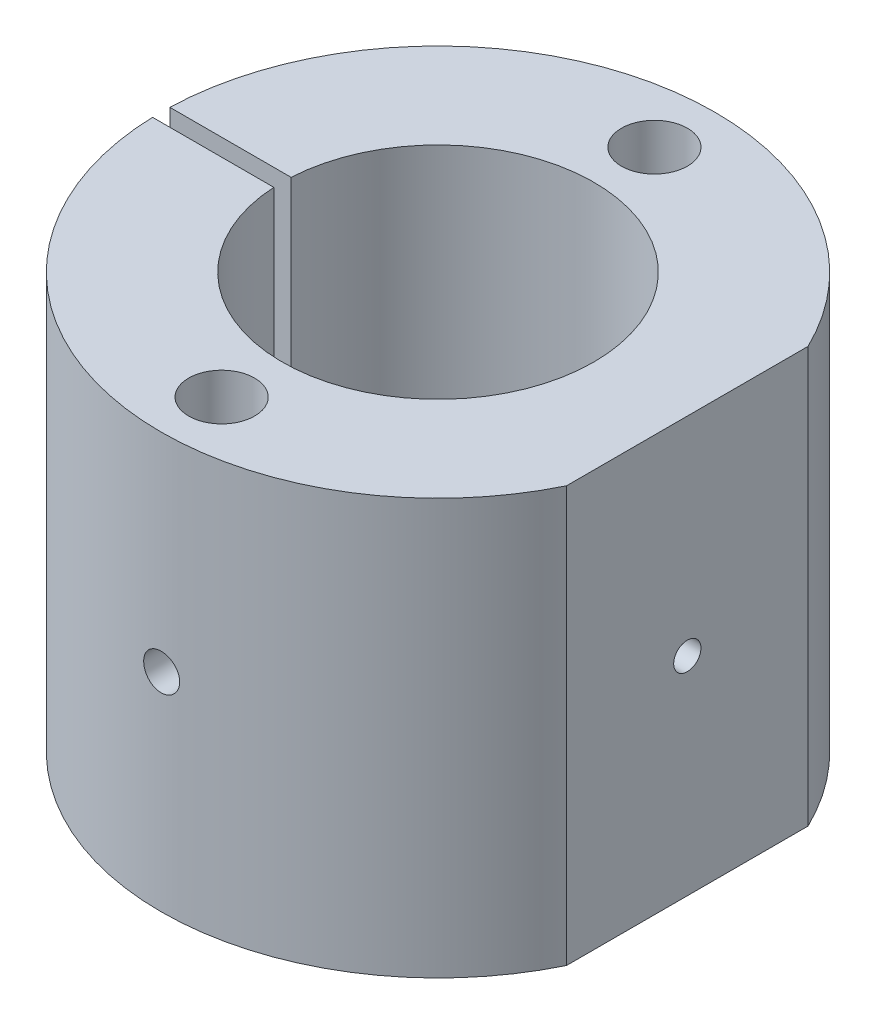
from build123d import *

# Parameters (mm, degrees)
SKETCH2_R                        = 25.4
SKETCH2_R_2                      = 14.2875
BOSS_EXTRUDE1_DEPTH              = 38.1
CUT_EXTRUDE1_REACH               = 54.363
SKETCH3_W                        = 25.4
SKETCH3_H                        = 1.5875
CUT_EXTRUDE2_REACH               = 54.363
SKETCH4_R                        = 3.0226
TAP_DRILL_FOR_M4X0_7_TAP1_REACH  = 61.824
TAP_DRILL_FOR_M4X0_7_TAP1_BORE_R = 1.65
CUT_EXTRUDE5_REACH               = 70.392
CUT_EXTRUDE5_END_RADIUS          = 3.0226
SKETCH11_R                       = 1.65
CUT_EXTRUDE6_REACH               = 54.363
TAP_DRILL_FOR_M3X0_5_TAP2_D      = 2.5
TAP_DRILL_FOR_M3X0_5_TAP2_DEPTH  = 4.572
TAP_DRILL_FOR_M3X0_5_TAP2_TIP    = 0.751075774
TAP_DRILL_FOR_M5X0_8_TAP1_REACH  = 55.583
TAP_DRILL_FOR_M5X0_8_TAP1_BORE_R = 2.1
SKETCH15_R                       = 2.665
CUT_EXTRUDE7_DEPTH               = 53.7470617
CUT_EXTRUDE8_REACH               = 59.143
SKETCH19_R                       = 5
SKETCH21_R                       = 2.665
CUT_EXTRUDE10_DEPTH              = 10


with BuildPart() as part:
    # Sketch2 → Boss-Extrude1 (new body)
    with BuildSketch(Plane(origin=(0, 0, 0), x_dir=(1, 0, 0), z_dir=(0, 1, 0))):
        with Locations(Location((0, 0, 0), (0, 0, 90))):
            Circle(SKETCH2_R)
        with Locations(Location((0, 0, 0), (0, 0, 90))):
            Circle(SKETCH2_R_2, mode=Mode.SUBTRACT)
    extrude(amount=BOSS_EXTRUDE1_DEPTH)

    # Sketch3 → Cut-Extrude1 (cut, up to next)
    with BuildSketch(Plane(origin=(0, 38.1, 0), x_dir=(1, 0, 0), z_dir=(0, 1, 0)), mode=Mode.PRIVATE) as cut_extrude1_sk1:
        with Locations((-12.7, 0)):
            Rectangle(SKETCH3_W, SKETCH3_H)
    cut_extrude1_tool1 = extrude(cut_extrude1_sk1.sketch, amount=-CUT_EXTRUDE1_REACH, mode=Mode.PRIVATE) & part.part
    add(cut_extrude1_tool1.solids().sort_by_distance((-12.7, 38.1, 0))[0], mode=Mode.SUBTRACT)

    # Sketch4 → Cut-Extrude2 (cut, up to next)
    with BuildSketch(Plane(origin=(0, 38.1, 0), x_dir=(1, 0, 0), z_dir=(0, 1, 0)), mode=Mode.PRIVATE) as cut_extrude2_sk1:
        with Locations(Location((0, -19.84375, 0), (0, 0, 270))):
            Circle(SKETCH4_R)
    cut_extrude2_tool1 = extrude(cut_extrude2_sk1.sketch, amount=-CUT_EXTRUDE2_REACH, mode=Mode.PRIVATE) & part.part
    cut_extrude2 = cut_extrude2_tool1.solids().sort_by_distance((0, 38.1, 19.84375))[0]
    add(cut_extrude2, mode=Mode.SUBTRACT)

    # Tap Drill for M4x0.7 Tap1 bore (on position points) → Tap Drill for M4x0.7 Tap1 (cut, up to next)
    with BuildSketch(Plane(origin=(-19.826514488, 29.109235595, 0.79375), x_dir=(-1, 0, 0), z_dir=(0, 0, -1)), mode=Mode.PRIVATE) as tap_drill_for_m4x0_7_tap1_sk1:
        Circle(TAP_DRILL_FOR_M4X0_7_TAP1_BORE_R)
    tap_drill_for_m4x0_7_tap1_tool1 = extrude(tap_drill_for_m4x0_7_tap1_sk1.sketch, amount=-TAP_DRILL_FOR_M4X0_7_TAP1_REACH, mode=Mode.PRIVATE) & part.part
    # Tap Drill for M4x0.7 Tap1 bore (on position points) → Tap Drill for M4x0.7 Tap1 (cut, up to next)
    with BuildSketch(Plane(origin=(-19.826514488, 29.109235595, 0.79375), x_dir=(-1, 0, 0), z_dir=(0, 0, -1)), mode=Mode.PRIVATE) as tap_drill_for_m4x0_7_tap1_sk2:
        with Locations((0, -20.205281104)):
            Circle(TAP_DRILL_FOR_M4X0_7_TAP1_BORE_R)
    tap_drill_for_m4x0_7_tap1_tool2 = extrude(tap_drill_for_m4x0_7_tap1_sk2.sketch, amount=-TAP_DRILL_FOR_M4X0_7_TAP1_REACH, mode=Mode.PRIVATE) & part.part
    add(tap_drill_for_m4x0_7_tap1_tool1.solids().sort_by_distance((-19.826514, 29.109236, 0.79375))[0], mode=Mode.SUBTRACT)
    add(tap_drill_for_m4x0_7_tap1_tool2.solids().sort_by_distance((-19.826514, 8.903954, 0.79375))[0], mode=Mode.SUBTRACT)

    # Cut-Extrude5: up to this cylinder (the profile starts outside it)
    cut_extrude5_end = Plane(origin=(0, 19.05, 19.84375), z_dir=(0, 1, 0)) * Cylinder(CUT_EXTRUDE5_END_RADIUS, 147.8292, mode=Mode.PRIVATE)
    # Sketch11 → Cut-Extrude5 (cut, up to the surface)
    with BuildSketch(Plane.XY.offset(25.4), mode=Mode.PRIVATE) as cut_extrude5_sk1:
        with Locations((0.006202687, 19.05)):
            Circle(SKETCH11_R)
    cut_extrude5_tool1 = extrude(cut_extrude5_sk1.sketch, amount=-CUT_EXTRUDE5_REACH, mode=Mode.PRIVATE) - cut_extrude5_end
    cut_extrude5 = cut_extrude5_tool1.solids().sort_by_distance((0.006203, 19.05, 25.4))[0]
    add(cut_extrude5, mode=Mode.SUBTRACT)

    # Mirror1: Cut-Extrude2, Cut-Extrude5 across plane
    add(cut_extrude2.mirror(Plane.XY), mode=Mode.SUBTRACT)
    add(cut_extrude5.mirror(Plane.XY), mode=Mode.SUBTRACT)

    # Sketch12 → Cut-Extrude6 (cut, up to next)
    with BuildSketch(Plane(origin=(0, 38.1, 0), x_dir=(1, 0, 0), z_dir=(0, 1, 0)), mode=Mode.PRIVATE) as cut_extrude6_sk1:
        with BuildLine():
            Line((22.86, 11.071603317), (22.86, -11.071603317))
            ThreePointArc((22.86, -11.071603317), (25.4, 0), (22.86, 11.071603317))
        make_face()
    cut_extrude6_tool1 = extrude(cut_extrude6_sk1.sketch, amount=-CUT_EXTRUDE6_REACH, mode=Mode.PRIVATE) & part.part
    add(cut_extrude6_tool1.solids().sort_by_distance((23.880484, 38.1, 0))[0], mode=Mode.SUBTRACT)

    # Tap Drill for M3x0.5 Tap2
    with Locations(Plane(origin=(22.86, 19.05, 0), x_dir=(0, 0, 1), z_dir=(1, 0, 0))):
        with Locations((0, 0)):
            Hole(TAP_DRILL_FOR_M3X0_5_TAP2_D / 2, depth=TAP_DRILL_FOR_M3X0_5_TAP2_DEPTH)
            with Locations((0, 0, -(TAP_DRILL_FOR_M3X0_5_TAP2_DEPTH + TAP_DRILL_FOR_M3X0_5_TAP2_TIP / 2))):  # 118° drill point
                Cone(0, TAP_DRILL_FOR_M3X0_5_TAP2_D / 2, TAP_DRILL_FOR_M3X0_5_TAP2_TIP, mode=Mode.SUBTRACT)

    # Tap Drill for M5x0.8 Tap1 bore (on position points) → Tap Drill for M5x0.8 Tap1 (cut, up to next)
    with BuildSketch(Plane(origin=(-19.826514488, 19.05, 0.79375), x_dir=(-1, 0, 0), z_dir=(0, 0, -1)), mode=Mode.PRIVATE) as tap_drill_for_m5x0_8_tap1_sk1:
        Circle(TAP_DRILL_FOR_M5X0_8_TAP1_BORE_R)
    tap_drill_for_m5x0_8_tap1_tool1 = extrude(tap_drill_for_m5x0_8_tap1_sk1.sketch, amount=-TAP_DRILL_FOR_M5X0_8_TAP1_REACH, mode=Mode.PRIVATE) & part.part
    add(tap_drill_for_m5x0_8_tap1_tool1.solids().sort_by_distance((-19.826514, 19.05, 0.79375))[0], mode=Mode.SUBTRACT)

    # Sketch15 → Cut-Extrude7 (cut, through all)
    with BuildSketch(Plane(origin=(0, 0, 0.79375), x_dir=(-1, 0, 0), z_dir=(0, 0, -1))):
        with Locations(Location((19.826514488, 19.05, 0), (0, 0, 180))):
            Circle(SKETCH15_R)
    extrude(amount=CUT_EXTRUDE7_DEPTH, mode=Mode.SUBTRACT)

    # Sketch19 → Cut-Extrude8 (cut, up to next)
    with BuildSketch(Plane.XY.offset(-8.79375), mode=Mode.PRIVATE) as cut_extrude8_sk1:
        with Locations((-19.826514488, 19.05)):
            Circle(SKETCH19_R)
    cut_extrude8_tool1 = extrude(cut_extrude8_sk1.sketch, amount=-CUT_EXTRUDE8_REACH, mode=Mode.PRIVATE) & part.part
    add(cut_extrude8_tool1.solids().sort_by_distance((-19.826514, 19.05, -8.79375))[0], mode=Mode.SUBTRACT)

    # Sketch21 → Cut-Extrude10 (cut)
    with BuildSketch(Plane.XZ):
        with Locations(Location((18.57375, -10, 0), (0, 0, 270))):
            Circle(SKETCH21_R)
        with Locations(Location((18.57375, 10, 0), (0, 0, 90))):
            Circle(SKETCH21_R)
    extrude(amount=-CUT_EXTRUDE10_DEPTH, mode=Mode.SUBTRACT)


solid = part.part
